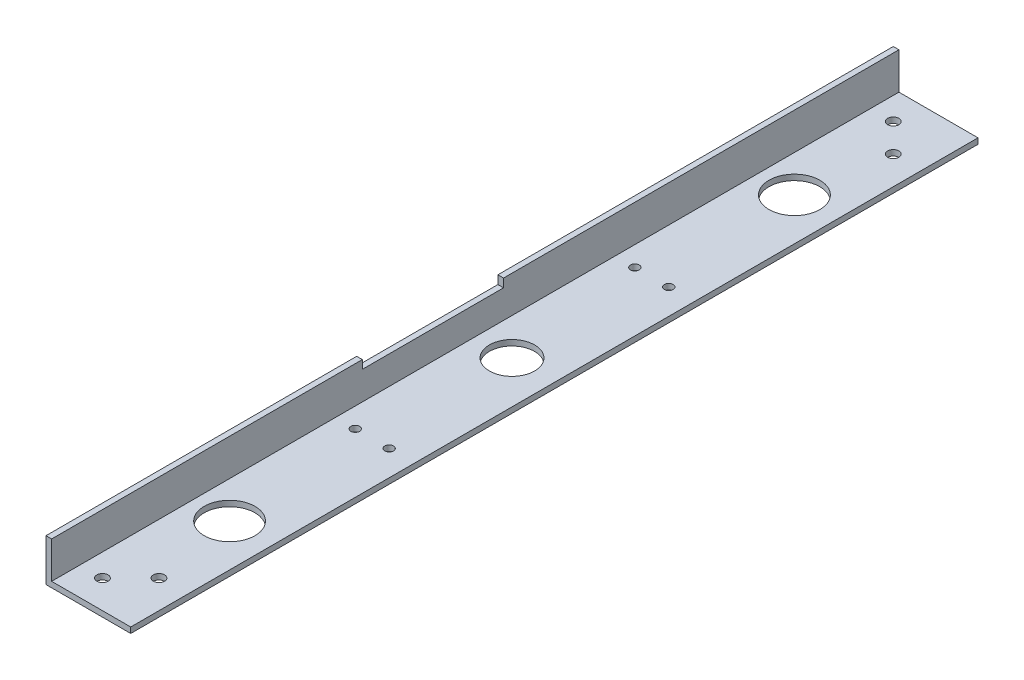
from build123d import *

# Parameters (mm, degrees)
BOSS_EXTRUDE1_DEPTH = 300
SKETCH2_R           = 8
SKETCH2_R_2         = 1.977693409
CUT_EXTRUDE1_DEPTH  = 10
SKETCH3_W           = 300
SKETCH3_H           = 10
CUT_EXTRUDE2_DEPTH  = 10
SKETCH4_W           = 50
SKETCH4_H           = 3
CUT_EXTRUDE3_DEPTH  = 10
SKETCH5_R           = 1.55
CUT_EXTRUDE4_DEPTH  = 273
SKETCH6_R           = 9
CUT_EXTRUDE5_DEPTH  = 5


with BuildPart() as part:
    # Sketch1 → Boss-Extrude1 (new body)
    with BuildSketch(Plane.XY):
        Polygon((0, 0), (0, 25), (2, 25), (2, 2), (30, 2), (30, 0), align=None)
    extrude(amount=BOSS_EXTRUDE1_DEPTH)

    # Sketch2 → Cut-Extrude1 (cut)
    with BuildSketch(Plane(origin=(0, 2, 0), x_dir=(1, 0, 0), z_dir=(0, 1, 0))):
        with Locations(Location((15, -150, 0), (0, 0, 180))):
            Circle(SKETCH2_R)
        with Locations(Location((10, -10, 0), (0, 0, 180))):
            Circle(SKETCH2_R_2)
        with Locations(Location((20, -20, 0), (0, 0, 180))):
            Circle(SKETCH2_R_2)
        with Locations(Location((10, -290, 0), (0, 0, 180))):
            Circle(SKETCH2_R_2)
        with Locations(Location((20, -280, 0), (0, 0, 180))):
            Circle(SKETCH2_R_2)
    extrude(amount=-CUT_EXTRUDE1_DEPTH, mode=Mode.SUBTRACT)

    # Sketch3 → Cut-Extrude2 (cut)
    with BuildSketch(Plane(origin=(2, 0, 0), x_dir=(0, 0, -1), z_dir=(1, 0, 0))):
        with Locations((-150, 20)):
            Rectangle(SKETCH3_W, SKETCH3_H)
    extrude(amount=-CUT_EXTRUDE2_DEPTH, mode=Mode.SUBTRACT)

    # Sketch4 → Cut-Extrude3 (cut)
    with BuildSketch(Plane(origin=(2, 0, 0), x_dir=(0, 0, -1), z_dir=(1, 0, 0))):
        with Locations((-165, 13.5)):
            Rectangle(SKETCH4_W, SKETCH4_H)
    extrude(amount=-CUT_EXTRUDE3_DEPTH, mode=Mode.SUBTRACT)

    # Sketch5 → Cut-Extrude4 (cut)
    with BuildSketch(Plane.XZ):
        with Locations((21, 199.5)):
            Circle(SKETCH5_R)
        with Locations((9, 199.5)):
            Circle(SKETCH5_R)
        with Locations((21, 100.5)):
            Circle(SKETCH5_R)
        with Locations((9, 100.5)):
            Circle(SKETCH5_R)
    extrude(amount=-CUT_EXTRUDE4_DEPTH, mode=Mode.SUBTRACT)

    # Sketch6 → Cut-Extrude5 (cut)
    with BuildSketch(Plane.XZ):
        with Locations((15, 250)):
            Circle(SKETCH6_R)
        with Locations((15, 50)):
            Circle(SKETCH6_R)
        with Locations((-238, 50)):
            Circle(SKETCH6_R)
        with Locations((-238, 250)):
            Circle(SKETCH6_R)
    extrude(amount=-CUT_EXTRUDE5_DEPTH, mode=Mode.SUBTRACT)


solid = part.part
